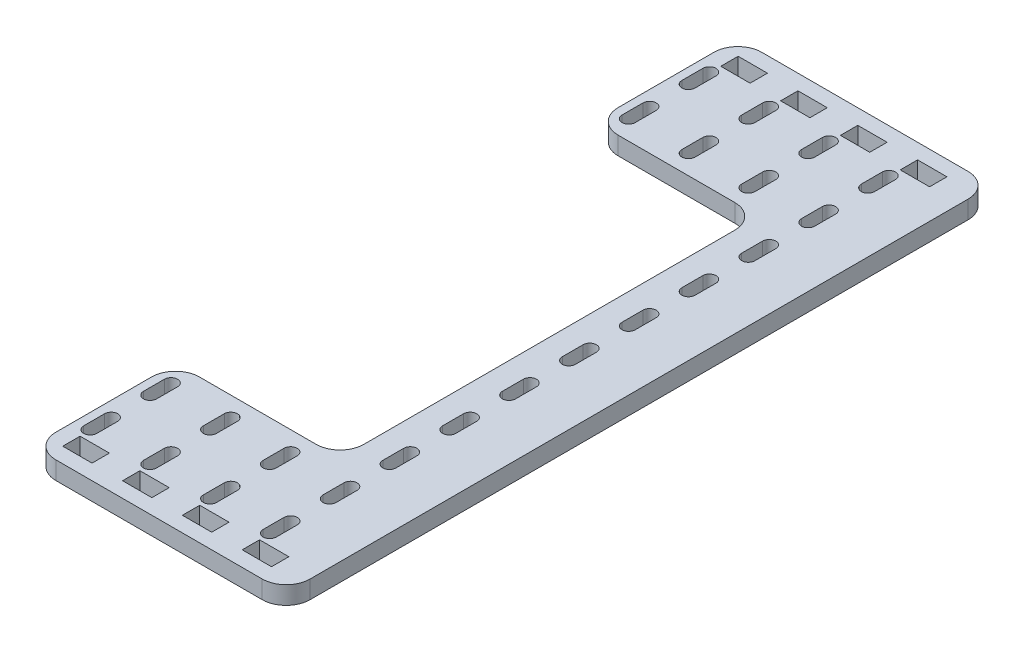
from build123d import *

# Parameters (mm, degrees)
SKETCH1_W           = 85
SKETCH1_H           = 236
BOSS_EXTRUDE1_DEPTH = 6
SKETCH2_W           = 9.8
SKETCH2_H           = 5.8
CUT_EXTRUDE1_DEPTH  = 6
CUT_EXTRUDE2_DEPTH  = 127.360868241
SKETCH5_W           = 55
SKETCH5_H           = 140
CUT_EXTRUDE3_DEPTH  = 127.360868241
FILLET1_R           = 8


with BuildPart() as part:
    # Sketch1 → Boss-Extrude1 (new body)
    with BuildSketch(Plane(origin=(0, 0, 0), x_dir=(1, 0, 0), z_dir=(0, 1, 0))):
        with Locations((-0.623184748, -0.623184748)):
            Rectangle(SKETCH1_W, SKETCH1_H)
    extrude(amount=BOSS_EXTRUDE1_DEPTH)

    # Sketch2 → Cut-Extrude1 (cut)
    with BuildSketch(Plane(origin=(0, 6, 0), x_dir=(1, 0, 0), z_dir=(0, 1, 0))):
        with Locations((6.976815252, -110.623184748)):
            Rectangle(SKETCH2_W, SKETCH2_H)
        with Locations((26.976815252, -110.623184748)):
            Rectangle(SKETCH2_W, SKETCH2_H)
        with Locations((-13.023184748, -110.623184748)):
            Rectangle(SKETCH2_W, SKETCH2_H)
        with Locations((-33.023184748, -110.623184748)):
            Rectangle(SKETCH2_W, SKETCH2_H)
    cut_extrude1 = extrude(amount=-CUT_EXTRUDE1_DEPTH, mode=Mode.SUBTRACT)

    # Mirror2: Cut-Extrude1 across plane
    add(cut_extrude1.mirror(Plane.XY.offset(0.623184748)), mode=Mode.SUBTRACT)

    # Sketch4 → Cut-Extrude2 (cut, through all)
    with BuildSketch(Plane(origin=(0, 6, 0), x_dir=(1, 0, 0), z_dir=(0, 1, 0))):
        with BuildLine():
            Line((19.676815252, 95.876815252), (19.676815252, 102.876815252))
            ThreePointArc((19.676815252, 102.876815252), (21.876815252, 105.076815252), (24.076815252, 102.876815252))
            Line((24.076815252, 102.876815252), (24.076815252, 95.876815252))
            ThreePointArc((24.076815252, 95.876815252), (21.876815252, 93.676815252), (19.676815252, 95.876815252))
        make_face()
        with BuildLine():
            ThreePointArc((19.676815252, 82.876815252), (21.876815252, 85.076815252), (24.076815252, 82.876815252))
            Line((24.076815252, 82.876815252), (24.076815252, 75.876815252))
            ThreePointArc((24.076815252, 75.876815252), (21.876815252, 73.676815252), (19.676815252, 75.876815252))
            Line((19.676815252, 75.876815252), (19.676815252, 82.876815252))
        make_face()
        with BuildLine():
            ThreePointArc((19.676815252, 62.876815252), (21.876815252, 65.076815252), (24.076815252, 62.876815252))
            Line((24.076815252, 62.876815252), (24.076815252, 55.876815252))
            ThreePointArc((24.076815252, 55.876815252), (21.876815252, 53.676815252), (19.676815252, 55.876815252))
            Line((19.676815252, 55.876815252), (19.676815252, 62.876815252))
        make_face()
        with BuildLine():
            ThreePointArc((19.676815252, 42.876815252), (21.876815252, 45.076815252), (24.076815252, 42.876815252))
            Line((24.076815252, 42.876815252), (24.076815252, 35.876815252))
            ThreePointArc((24.076815252, 35.876815252), (21.876815252, 33.676815252), (19.676815252, 35.876815252))
            Line((19.676815252, 35.876815252), (19.676815252, 42.876815252))
        make_face()
        with BuildLine():
            ThreePointArc((-0.323184748, 42.876815252), (1.876815252, 45.076815252), (4.076815252, 42.876815252))
            Line((4.076815252, 42.876815252), (4.076815252, 35.876815252))
            ThreePointArc((4.076815252, 35.876815252), (1.876815252, 33.676815252), (-0.323184748, 35.876815252))
            Line((-0.323184748, 35.876815252), (-0.323184748, 42.876815252))
        make_face()
        with BuildLine():
            ThreePointArc((-0.323184748, 62.876815252), (1.876815252, 65.076815252), (4.076815252, 62.876815252))
            Line((4.076815252, 62.876815252), (4.076815252, 55.876815252))
            ThreePointArc((4.076815252, 55.876815252), (1.876815252, 53.676815252), (-0.323184748, 55.876815252))
            Line((-0.323184748, 55.876815252), (-0.323184748, 62.876815252))
        make_face()
        with BuildLine():
            ThreePointArc((-0.323184748, 82.876815252), (1.876815252, 85.076815252), (4.076815252, 82.876815252))
            Line((4.076815252, 82.876815252), (4.076815252, 75.876815252))
            ThreePointArc((4.076815252, 75.876815252), (1.876815252, 73.676815252), (-0.323184748, 75.876815252))
            Line((-0.323184748, 75.876815252), (-0.323184748, 82.876815252))
        make_face()
        with BuildLine():
            ThreePointArc((-0.323184748, 102.876815252), (1.876815252, 105.076815252), (4.076815252, 102.876815252))
            Line((4.076815252, 102.876815252), (4.076815252, 95.876815252))
            ThreePointArc((4.076815252, 95.876815252), (1.876815252, 93.676815252), (-0.323184748, 95.876815252))
            Line((-0.323184748, 95.876815252), (-0.323184748, 102.876815252))
        make_face()
        with BuildLine():
            ThreePointArc((-20.323184748, 82.876815252), (-18.123184748, 85.076815252), (-15.923184748, 82.876815252))
            Line((-15.923184748, 82.876815252), (-15.923184748, 75.876815252))
            ThreePointArc((-15.923184748, 75.876815252), (-18.123184748, 73.676815252), (-20.323184748, 75.876815252))
            Line((-20.323184748, 75.876815252), (-20.323184748, 82.876815252))
        make_face()
        with BuildLine():
            ThreePointArc((-20.323184748, 102.876815252), (-18.123184748, 105.076815252), (-15.923184748, 102.876815252))
            Line((-15.923184748, 102.876815252), (-15.923184748, 95.876815252))
            ThreePointArc((-15.923184748, 95.876815252), (-18.123184748, 93.676815252), (-20.323184748, 95.876815252))
            Line((-20.323184748, 95.876815252), (-20.323184748, 102.876815252))
        make_face()
        with BuildLine():
            ThreePointArc((-20.323184748, 62.876815252), (-18.123184748, 65.076815252), (-15.923184748, 62.876815252))
            Line((-15.923184748, 62.876815252), (-15.923184748, 55.876815252))
            ThreePointArc((-15.923184748, 55.876815252), (-18.123184748, 53.676815252), (-20.323184748, 55.876815252))
            Line((-20.323184748, 55.876815252), (-20.323184748, 62.876815252))
        make_face()
        with BuildLine():
            ThreePointArc((-20.323184748, 42.876815252), (-18.123184748, 45.076815252), (-15.923184748, 42.876815252))
            Line((-15.923184748, 42.876815252), (-15.923184748, 35.876815252))
            ThreePointArc((-15.923184748, 35.876815252), (-18.123184748, 33.676815252), (-20.323184748, 35.876815252))
            Line((-20.323184748, 35.876815252), (-20.323184748, 42.876815252))
        make_face()
        with BuildLine():
            ThreePointArc((-20.323184748, 22.876815252), (-18.123184748, 25.076815252), (-15.923184748, 22.876815252))
            Line((-15.923184748, 22.876815252), (-15.923184748, 15.876815252))
            ThreePointArc((-15.923184748, 15.876815252), (-18.123184748, 13.676815252), (-20.323184748, 15.876815252))
            Line((-20.323184748, 15.876815252), (-20.323184748, 22.876815252))
        make_face()
        with BuildLine():
            ThreePointArc((-0.323184748, 22.876815252), (1.876815252, 25.076815252), (4.076815252, 22.876815252))
            Line((4.076815252, 22.876815252), (4.076815252, 15.876815252))
            ThreePointArc((4.076815252, 15.876815252), (1.876815252, 13.676815252), (-0.323184748, 15.876815252))
            Line((-0.323184748, 15.876815252), (-0.323184748, 22.876815252))
        make_face()
        with BuildLine():
            ThreePointArc((19.676815252, 22.876815252), (21.876815252, 25.076815252), (24.076815252, 22.876815252))
            Line((24.076815252, 22.876815252), (24.076815252, 15.876815252))
            ThreePointArc((24.076815252, 15.876815252), (21.876815252, 13.676815252), (19.676815252, 15.876815252))
            Line((19.676815252, 15.876815252), (19.676815252, 22.876815252))
        make_face()
        with BuildLine():
            ThreePointArc((-0.323184748, 2.876815252), (1.876815252, 5.076815252), (4.076815252, 2.876815252))
            Line((4.076815252, 2.876815252), (4.076815252, -4.123184748))
            ThreePointArc((4.076815252, -4.123184748), (1.876815252, -6.323184748), (-0.323184748, -4.123184748))
            Line((-0.323184748, -4.123184748), (-0.323184748, 2.876815252))
        make_face()
        with BuildLine():
            ThreePointArc((-20.323184748, 2.876815252), (-18.123184748, 5.076815252), (-15.923184748, 2.876815252))
            Line((-15.923184748, 2.876815252), (-15.923184748, -4.123184748))
            ThreePointArc((-15.923184748, -4.123184748), (-18.123184748, -6.323184748), (-20.323184748, -4.123184748))
            Line((-20.323184748, -4.123184748), (-20.323184748, 2.876815252))
        make_face()
        with BuildLine():
            ThreePointArc((-40.323184748, 22.876815252), (-38.123184748, 25.076815252), (-35.923184748, 22.876815252))
            Line((-35.923184748, 22.876815252), (-35.923184748, 15.876815252))
            ThreePointArc((-35.923184748, 15.876815252), (-38.123184748, 13.676815252), (-40.323184748, 15.876815252))
            Line((-40.323184748, 15.876815252), (-40.323184748, 22.876815252))
        make_face()
        with BuildLine():
            ThreePointArc((-40.323184748, 42.876815252), (-38.123184748, 45.076815252), (-35.923184748, 42.876815252))
            Line((-35.923184748, 42.876815252), (-35.923184748, 35.876815252))
            ThreePointArc((-35.923184748, 35.876815252), (-38.123184748, 33.676815252), (-40.323184748, 35.876815252))
            Line((-40.323184748, 35.876815252), (-40.323184748, 42.876815252))
        make_face()
        with BuildLine():
            ThreePointArc((-40.323184748, 62.876815252), (-38.123184748, 65.076815252), (-35.923184748, 62.876815252))
            Line((-35.923184748, 62.876815252), (-35.923184748, 55.876815252))
            ThreePointArc((-35.923184748, 55.876815252), (-38.123184748, 53.676815252), (-40.323184748, 55.876815252))
            Line((-40.323184748, 55.876815252), (-40.323184748, 62.876815252))
        make_face()
        with BuildLine():
            ThreePointArc((-40.323184748, 82.876815252), (-38.123184748, 85.076815252), (-35.923184748, 82.876815252))
            Line((-35.923184748, 82.876815252), (-35.923184748, 75.876815252))
            ThreePointArc((-35.923184748, 75.876815252), (-38.123184748, 73.676815252), (-40.323184748, 75.876815252))
            Line((-40.323184748, 75.876815252), (-40.323184748, 82.876815252))
        make_face()
        with BuildLine():
            ThreePointArc((-40.323184748, 102.876815252), (-38.123184748, 105.076815252), (-35.923184748, 102.876815252))
            Line((-35.923184748, 102.876815252), (-35.923184748, 95.876815252))
            ThreePointArc((-35.923184748, 95.876815252), (-38.123184748, 93.676815252), (-40.323184748, 95.876815252))
            Line((-40.323184748, 95.876815252), (-40.323184748, 102.876815252))
        make_face()
        with BuildLine():
            ThreePointArc((19.676815252, 2.876815252), (21.876815252, 5.076815252), (24.076815252, 2.876815252))
            Line((24.076815252, 2.876815252), (24.076815252, -4.123184748))
            ThreePointArc((24.076815252, -4.123184748), (21.876815252, -6.323184748), (19.676815252, -4.123184748))
            Line((19.676815252, -4.123184748), (19.676815252, 2.876815252))
        make_face()
        with BuildLine():
            ThreePointArc((19.676815252, -17.123184748), (21.876815252, -14.923184748), (24.076815252, -17.123184748))
            Line((24.076815252, -17.123184748), (24.076815252, -24.123184748))
            ThreePointArc((24.076815252, -24.123184748), (21.876815252, -26.323184748), (19.676815252, -24.123184748))
            Line((19.676815252, -24.123184748), (19.676815252, -17.123184748))
        make_face()
        with BuildLine():
            ThreePointArc((19.676815252, -37.123184748), (21.876815252, -34.923184748), (24.076815252, -37.123184748))
            Line((24.076815252, -37.123184748), (24.076815252, -44.123184748))
            ThreePointArc((24.076815252, -44.123184748), (21.876815252, -46.323184748), (19.676815252, -44.123184748))
            Line((19.676815252, -44.123184748), (19.676815252, -37.123184748))
        make_face()
        with BuildLine():
            ThreePointArc((-0.323184748, -37.123184748), (1.876815252, -34.923184748), (4.076815252, -37.123184748))
            Line((4.076815252, -37.123184748), (4.076815252, -44.123184748))
            ThreePointArc((4.076815252, -44.123184748), (1.876815252, -46.323184748), (-0.323184748, -44.123184748))
            Line((-0.323184748, -44.123184748), (-0.323184748, -37.123184748))
        make_face()
        with BuildLine():
            ThreePointArc((-0.323184748, -17.123184748), (1.876815252, -14.923184748), (4.076815252, -17.123184748))
            Line((4.076815252, -17.123184748), (4.076815252, -24.123184748))
            ThreePointArc((4.076815252, -24.123184748), (1.876815252, -26.323184748), (-0.323184748, -24.123184748))
            Line((-0.323184748, -24.123184748), (-0.323184748, -17.123184748))
        make_face()
        with BuildLine():
            ThreePointArc((-20.323184748, -17.123184748), (-18.123184748, -14.923184748), (-15.923184748, -17.123184748))
            Line((-15.923184748, -17.123184748), (-15.923184748, -24.123184748))
            ThreePointArc((-15.923184748, -24.123184748), (-18.123184748, -26.323184748), (-20.323184748, -24.123184748))
            Line((-20.323184748, -24.123184748), (-20.323184748, -17.123184748))
        make_face()
        with BuildLine():
            ThreePointArc((-20.323184748, -37.123184748), (-18.123184748, -34.923184748), (-15.923184748, -37.123184748))
            Line((-15.923184748, -37.123184748), (-15.923184748, -44.123184748))
            ThreePointArc((-15.923184748, -44.123184748), (-18.123184748, -46.323184748), (-20.323184748, -44.123184748))
            Line((-20.323184748, -44.123184748), (-20.323184748, -37.123184748))
        make_face()
        with BuildLine():
            ThreePointArc((-40.323184748, -37.123184748), (-38.123184748, -34.923184748), (-35.923184748, -37.123184748))
            Line((-35.923184748, -37.123184748), (-35.923184748, -44.123184748))
            ThreePointArc((-35.923184748, -44.123184748), (-38.123184748, -46.323184748), (-40.323184748, -44.123184748))
            Line((-40.323184748, -44.123184748), (-40.323184748, -37.123184748))
        make_face()
        with BuildLine():
            ThreePointArc((-40.323184748, -17.123184748), (-38.123184748, -14.923184748), (-35.923184748, -17.123184748))
            Line((-35.923184748, -17.123184748), (-35.923184748, -24.123184748))
            ThreePointArc((-35.923184748, -24.123184748), (-38.123184748, -26.323184748), (-40.323184748, -24.123184748))
            Line((-40.323184748, -24.123184748), (-40.323184748, -17.123184748))
        make_face()
        with BuildLine():
            ThreePointArc((-40.323184748, 2.876815252), (-38.123184748, 5.076815252), (-35.923184748, 2.876815252))
            Line((-35.923184748, 2.876815252), (-35.923184748, -4.123184748))
            ThreePointArc((-35.923184748, -4.123184748), (-38.123184748, -6.323184748), (-40.323184748, -4.123184748))
            Line((-40.323184748, -4.123184748), (-40.323184748, 2.876815252))
        make_face()
        with BuildLine():
            ThreePointArc((19.676815252, -97.123184748), (21.876815252, -94.923184748), (24.076815252, -97.123184748))
            Line((24.076815252, -97.123184748), (24.076815252, -104.123184748))
            ThreePointArc((24.076815252, -104.123184748), (21.876815252, -106.323184748), (19.676815252, -104.123184748))
            Line((19.676815252, -104.123184748), (19.676815252, -97.123184748))
        make_face()
        with BuildLine():
            ThreePointArc((19.676815252, -77.123184748), (21.876815252, -74.923184748), (24.076815252, -77.123184748))
            Line((24.076815252, -77.123184748), (24.076815252, -84.123184748))
            ThreePointArc((24.076815252, -84.123184748), (21.876815252, -86.323184748), (19.676815252, -84.123184748))
            Line((19.676815252, -84.123184748), (19.676815252, -77.123184748))
        make_face()
        with BuildLine():
            ThreePointArc((19.676815252, -57.123184748), (21.876815252, -54.923184748), (24.076815252, -57.123184748))
            Line((24.076815252, -57.123184748), (24.076815252, -64.123184748))
            ThreePointArc((24.076815252, -64.123184748), (21.876815252, -66.323184748), (19.676815252, -64.123184748))
            Line((19.676815252, -64.123184748), (19.676815252, -57.123184748))
        make_face()
        with BuildLine():
            ThreePointArc((-0.323184748, -57.123184748), (1.876815252, -54.923184748), (4.076815252, -57.123184748))
            Line((4.076815252, -57.123184748), (4.076815252, -64.123184748))
            ThreePointArc((4.076815252, -64.123184748), (1.876815252, -66.323184748), (-0.323184748, -64.123184748))
            Line((-0.323184748, -64.123184748), (-0.323184748, -57.123184748))
        make_face()
        with BuildLine():
            ThreePointArc((-0.323184748, -77.123184748), (1.876815252, -74.923184748), (4.076815252, -77.123184748))
            Line((4.076815252, -77.123184748), (4.076815252, -84.123184748))
            ThreePointArc((4.076815252, -84.123184748), (1.876815252, -86.323184748), (-0.323184748, -84.123184748))
            Line((-0.323184748, -84.123184748), (-0.323184748, -77.123184748))
        make_face()
        with BuildLine():
            ThreePointArc((-0.323184748, -97.123184748), (1.876815252, -94.923184748), (4.076815252, -97.123184748))
            Line((4.076815252, -97.123184748), (4.076815252, -104.123184748))
            ThreePointArc((4.076815252, -104.123184748), (1.876815252, -106.323184748), (-0.323184748, -104.123184748))
            Line((-0.323184748, -104.123184748), (-0.323184748, -97.123184748))
        make_face()
        with BuildLine():
            ThreePointArc((-20.323184748, -97.123184748), (-18.123184748, -94.923184748), (-15.923184748, -97.123184748))
            Line((-15.923184748, -97.123184748), (-15.923184748, -104.123184748))
            ThreePointArc((-15.923184748, -104.123184748), (-18.123184748, -106.323184748), (-20.323184748, -104.123184748))
            Line((-20.323184748, -104.123184748), (-20.323184748, -97.123184748))
        make_face()
        with BuildLine():
            ThreePointArc((-40.323184748, -97.123184748), (-38.123184748, -94.923184748), (-35.923184748, -97.123184748))
            Line((-35.923184748, -97.123184748), (-35.923184748, -104.123184748))
            ThreePointArc((-35.923184748, -104.123184748), (-38.123184748, -106.323184748), (-40.323184748, -104.123184748))
            Line((-40.323184748, -104.123184748), (-40.323184748, -97.123184748))
        make_face()
        with BuildLine():
            ThreePointArc((-40.323184748, -77.123184748), (-38.123184748, -74.923184748), (-35.923184748, -77.123184748))
            Line((-35.923184748, -77.123184748), (-35.923184748, -84.123184748))
            ThreePointArc((-35.923184748, -84.123184748), (-38.123184748, -86.323184748), (-40.323184748, -84.123184748))
            Line((-40.323184748, -84.123184748), (-40.323184748, -77.123184748))
        make_face()
        with BuildLine():
            ThreePointArc((-20.323184748, -77.123184748), (-18.123184748, -74.923184748), (-15.923184748, -77.123184748))
            Line((-15.923184748, -77.123184748), (-15.923184748, -84.123184748))
            ThreePointArc((-15.923184748, -84.123184748), (-18.123184748, -86.323184748), (-20.323184748, -84.123184748))
            Line((-20.323184748, -84.123184748), (-20.323184748, -77.123184748))
        make_face()
        with BuildLine():
            ThreePointArc((-20.323184748, -57.123184748), (-18.123184748, -54.923184748), (-15.923184748, -57.123184748))
            Line((-15.923184748, -57.123184748), (-15.923184748, -64.123184748))
            ThreePointArc((-15.923184748, -64.123184748), (-18.123184748, -66.323184748), (-20.323184748, -64.123184748))
            Line((-20.323184748, -64.123184748), (-20.323184748, -57.123184748))
        make_face()
        with BuildLine():
            ThreePointArc((-40.323184748, -57.123184748), (-38.123184748, -54.923184748), (-35.923184748, -57.123184748))
            Line((-35.923184748, -57.123184748), (-35.923184748, -64.123184748))
            ThreePointArc((-35.923184748, -64.123184748), (-38.123184748, -66.323184748), (-40.323184748, -64.123184748))
            Line((-40.323184748, -64.123184748), (-40.323184748, -57.123184748))
        make_face()
    extrude(amount=-CUT_EXTRUDE2_DEPTH, mode=Mode.SUBTRACT)

    # Sketch5 → Cut-Extrude3 (cut, through all)
    with BuildSketch(Plane(origin=(0, 6, 0), x_dir=(1, 0, 0), z_dir=(0, 1, 0))):
        with Locations((-15.623184748, -0.623184748)):
            Rectangle(SKETCH5_W, SKETCH5_H)
    extrude(amount=-CUT_EXTRUDE3_DEPTH, mode=Mode.SUBTRACT)

    # Fillet1
    fillet1_edges = [part.edges().sort_by_distance(p)[0] for p in [
        (-43.123184748, 3, -117.376815252),
        (41.876815252, 3, -117.376815252),
        (-43.123184748, 3, 70.623184748),
        (-43.123184748, 3, -69.376815252),
        (11.876815252, 3, -69.376815252),
        (11.876815252, 3, 70.623184748),
        (41.876815252, 3, 118.623184748),
        (-43.123184748, 3, 118.623184748),
    ]]
    fillet(fillet1_edges, radius=FILLET1_R)


solid = part.part
